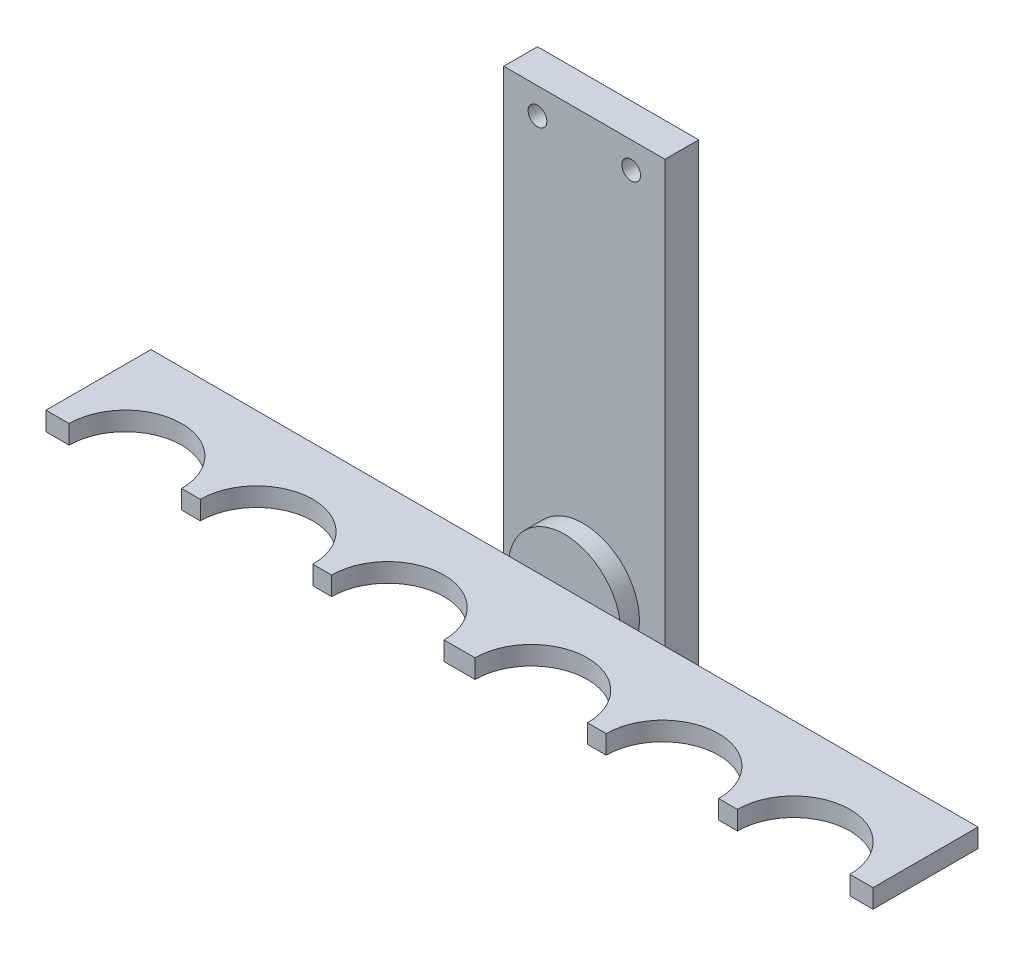
from build123d import *

# Parameters (mm, degrees)
SKETCH_1_W          = 43
SKETCH_1_H          = 110
SKETCH_1_W_2        = 21.5
SKETCH_1_H_2        = 15
SKETCH_1_R          = 2.5
EXTRUDE_1_DEPTH     = 9
SKETCH_4_R          = 15
EXTRUDE_2_DEPTH     = 5
SKETCH_5_W          = 220.601907976
SKETCH_5_H          = 5
EXTRUDE_3_DEPTH     = 28
SKETCH_6_R          = 15
CUT_EXTRUDE_1_DEPTH = 28


with BuildPart() as part:
    # 草图1 → 凸台-拉伸1 (new body)
    # profile 1 of 3: a face of its own
    with BuildSketch(Plane.XY):
        with Locations((0.290540541, -64.442567568)):
            Rectangle(SKETCH_1_W, SKETCH_1_H)
    # profile 2 of 3: a face of its own
    with BuildSketch(Plane.XY):
        with Locations((11.040540541, -1.942567568)):
            Rectangle(SKETCH_1_W_2, SKETCH_1_H_2)
        with Locations((12.790540541, -1.442567568)):
            Circle(SKETCH_1_R, mode=Mode.SUBTRACT)
    # profile 3 of 3: a face of its own
    with BuildSketch(Plane.XY):
        with Locations((-10.459459459, -1.942567568)):
            Rectangle(SKETCH_1_W_2, SKETCH_1_H_2)
        with Locations((-12.209459459, -1.442567568)):
            Circle(SKETCH_1_R, mode=Mode.SUBTRACT)
    extrude(amount=EXTRUDE_1_DEPTH)

    # 草图4 → 凸台-拉伸2 (add)
    with BuildSketch(Plane.XY.offset(9)):
        with Locations(Location((0, -104.442567568, 0), (0, 0, 270))):
            Circle(SKETCH_4_R)
    extrude(amount=EXTRUDE_2_DEPTH)

    # 草图5 → 凸台-拉伸3 (add)
    with BuildSketch(Plane.XY.offset(14)):
        with Locations((0, -104.442567568)):
            Rectangle(SKETCH_5_W, SKETCH_5_H)
    extrude(amount=EXTRUDE_3_DEPTH)

    # 草图6 → 切除-拉伸1 (cut)
    with BuildSketch(Plane(origin=(0, -106.942567568, 0), x_dir=(-1, 0, 0), z_dir=(0, -1, 0))):
        with Locations((-19.127702363, -42)):
            Circle(SKETCH_6_R)
        with Locations((-54.127702363, -42)):
            Circle(SKETCH_6_R)
        with Locations((-89.127702363, -42)):
            Circle(SKETCH_6_R)
        with Locations((19.127702363, -42)):
            Circle(SKETCH_6_R)
        with Locations((54.127702363, -42)):
            Circle(SKETCH_6_R)
        with Locations((89.127702363, -42)):
            Circle(SKETCH_6_R)
    extrude(amount=-CUT_EXTRUDE_1_DEPTH, mode=Mode.SUBTRACT)


solid = part.part
